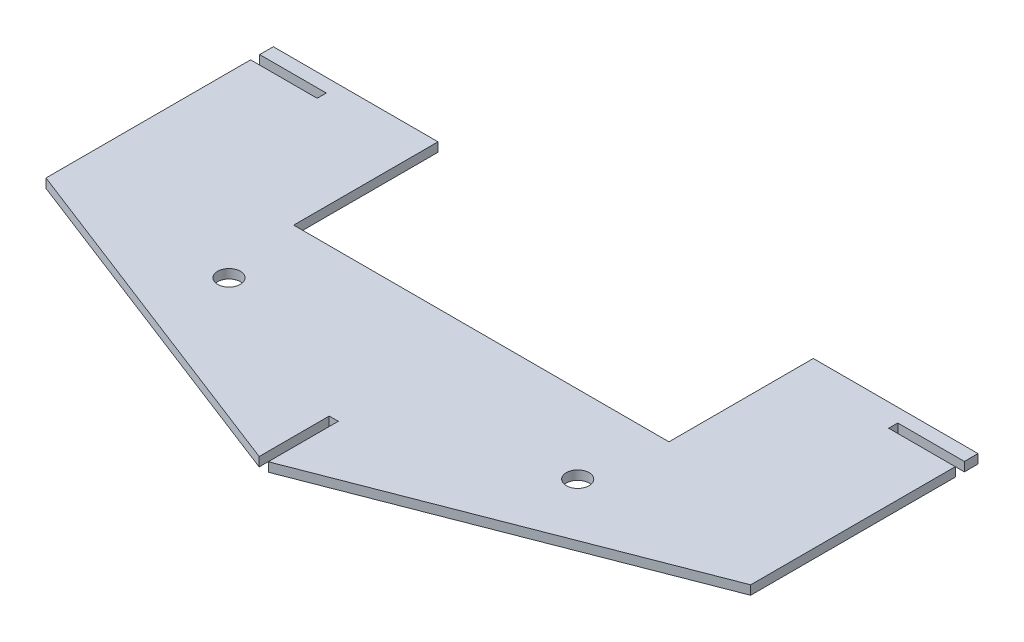
from build123d import *

# Parameters (mm, degrees)
BOSS_EXTRUDE1_DEPTH = 4
SKETCH2_W           = 165.1
SKETCH2_H           = 63.5
CUT_EXTRUDE1_DEPTH  = 349.523826216
CUT_EXTRUDE2_DEPTH  = 10


with BuildPart() as part:
    # Sketch1 → Boss-Extrude1 (new body)
    with BuildSketch(Plane(origin=(0, 0, 0), x_dir=(1, 0, 0), z_dir=(0, 1, 0))):
        Polygon((310, -100), (310, -10), (280.7, -10), (280.7, -6), (310, -6), (310, 0), (0, 0), (0, -6), (29.3, -6), (29.3, -10), (0, -10), (0, -100), (153, -159.225806452), (153, -128.4), (157, -128.4), (157, -159.225806452), align=None)
    extrude(amount=BOSS_EXTRUDE1_DEPTH)

    # Sketch2 → Cut-Extrude1 (cut, through all)
    with BuildSketch(Plane(origin=(0, 4, 0), x_dir=(1, 0, 0), z_dir=(0, 1, 0))):
        with Locations((155, -31.75)):
            Rectangle(SKETCH2_W, SKETCH2_H)
    extrude(amount=-CUT_EXTRUDE1_DEPTH, mode=Mode.SUBTRACT)

    # Sketch4 → Cut-Extrude2 (cut)
    with BuildSketch(Plane(origin=(0, 4, 0), x_dir=(1, 0, 0), z_dir=(0, 1, 0))):
        with BuildLine():
            ThreePointArc((73.3, -97.8), (73.429171307, -98.929171307), (73.810011136, -100))
            Line((73.810011136, -100), (78.3, -100))
            Line((78.3, -100), (78.3, -97.8))
            Line((78.3, -97.8), (73.3, -97.8))
        make_face()
        with BuildLine():
            Line((78.3, -100), (73.810011136, -100))
            ThreePointArc((73.810011136, -100), (79.429171307, -102.670828693), (83.3, -97.8))
            ThreePointArc((83.3, -97.8), (78.3, -92.8), (73.3, -97.8))
            Line((73.3, -97.8), (78.3, -97.8))
            Line((78.3, -97.8), (78.3, -100))
        make_face()
        with BuildLine():
            Line((236.189988864, -100), (231.7, -100))
            Line((231.7, -100), (231.7, -97.8))
            Line((231.7, -97.8), (236.7, -97.8))
            ThreePointArc((236.7, -97.8), (226.829171307, -96.670828693), (236.189988864, -100))
        make_face()
        with BuildLine():
            Line((231.7, -97.8), (231.7, -100))
            Line((231.7, -100), (236.189988864, -100))
            ThreePointArc((236.189988864, -100), (236.570828693, -98.929171307), (236.7, -97.8))
            Line((236.7, -97.8), (231.7, -97.8))
        make_face()
    extrude(amount=-CUT_EXTRUDE2_DEPTH, mode=Mode.SUBTRACT)


solid = part.part
